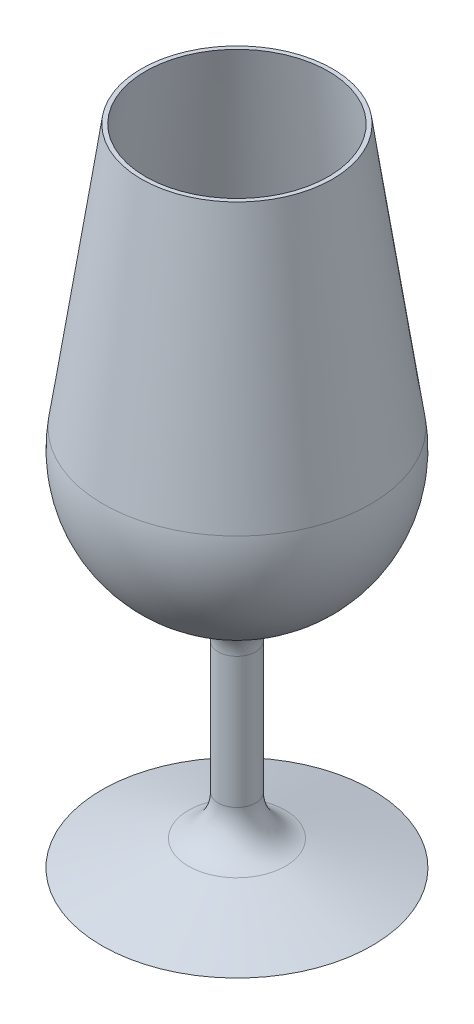
from build123d import *


with BuildPart() as part:
    # Sketch2 → Revolve1 (revolve)
    with BuildSketch(Plane.XY, mode=Mode.PRIVATE) as revolve1_sk:
        with BuildLine():
            Line((0, -37.091298276), (32.5, -37.091298276))
            Line((32.5, -37.091298276), (11.66645179, -30.935726736))
            ThreePointArc((11.66645179, -30.935726736), (6.489523045, -27.331580559), (4.5, -21.345575301))
            Line((4.5, -21.345575301), (4.5, 10.145686892))
            ThreePointArc((4.5, 10.145686892), (6.311054798, 15.885127323), (11.088235294, 19.545679529))
            ThreePointArc((11.088235294, 19.545679529), (27.887861488, 33.406821561), (32.163132951, 54.762868775))
            Line((32.163132951, 54.762868775), (23, 117.908701724))
            Line((23, 117.908701724), (21.989526299, 117.908701724))
            Line((21.989526299, 117.908701724), (31.173498091, 54.619262216))
            ThreePointArc((31.173498091, 54.619262216), (23.819567674, 29.483081871), (0, 18.595655602))
            Line((0, 18.595655602), (0, -37.091298276))
        make_face()
    revolve(revolve1_sk.sketch.rotate(Axis((0, 117.908701724, 0), (0, -1, 0)), 90), axis=Axis((0, 117.908701724, 0), (0, -1, 0)))


solid = part.part
